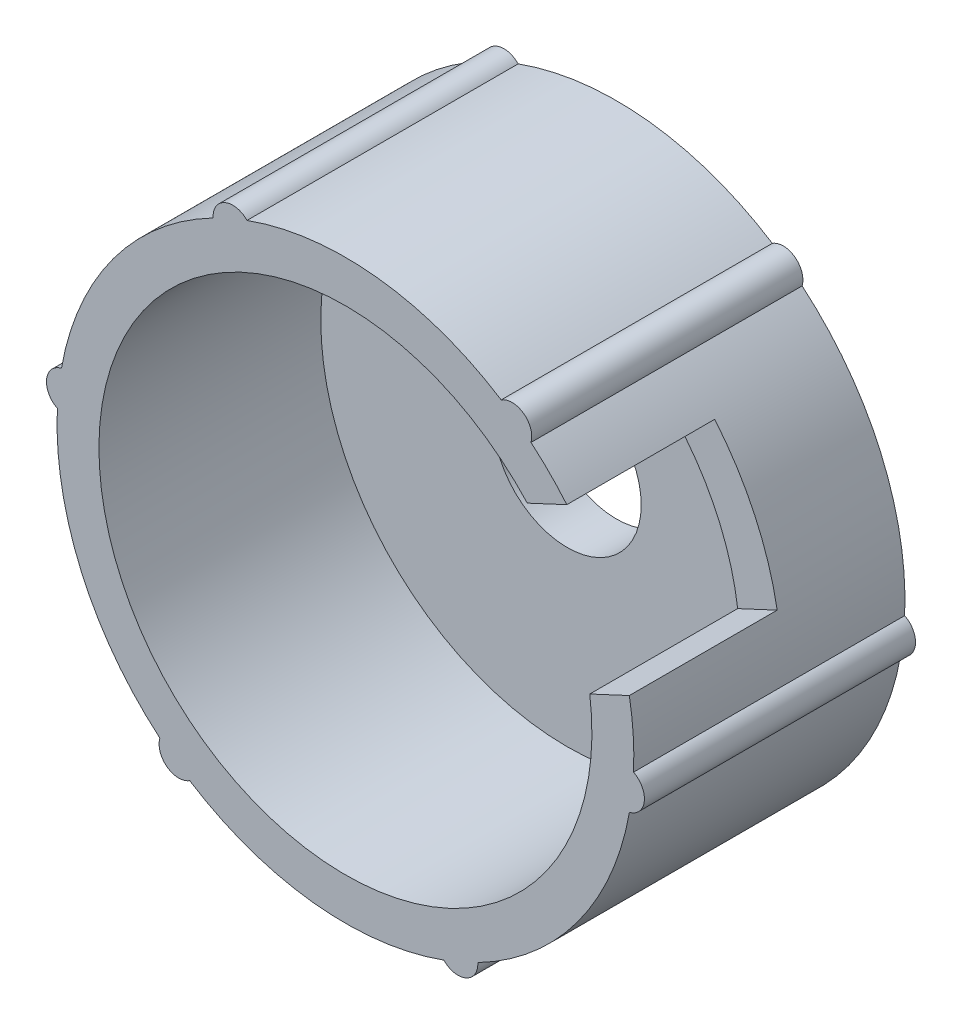
from build123d import *

# Parameters (mm, degrees)
SKIZZE2_R                       = 5
AUFSATZ_LINEAR_AUSTRAGEN1_DEPTH = 1
SKIZZE2_4_R                     = 5.85
SKIZZE2_4_R_2                   = 5
AUFSATZ_LINEAR_AUSTRAGEN2_DEPTH = 5.5
SKIZZE3_R                       = 0.4
AUFSATZ_LINEAR_AUSTRAGEN3_DEPTH = 5.5
KREISMUSTER1_COUNT              = 6
SCHNITT_LINEAR_AUSTRAGEN1_DEPTH = 3
SKIZZE5_R                       = 1.5
SCHNITT_LINEAR_AUSTRAGEN2_DEPTH = 102.03637778


with BuildPart() as part:
    # Skizze2 → Aufsatz-Linear austragen1 (new body)
    with BuildSketch(Plane.XY.offset(7.9)):
        with Locations((94, 7)):
            Circle(SKIZZE2_R)
    extrude(amount=AUFSATZ_LINEAR_AUSTRAGEN1_DEPTH)

    # Skizze2<4> → Aufsatz-Linear austragen2 (add)
    with BuildSketch(Plane.XY.offset(7.9)):
        with Locations(Location((94, 7, 0), (0, 0, 180))):
            Circle(SKIZZE2_4_R)
        with Locations(Location((94, 7, 0), (0, 0, 180))):
            Circle(SKIZZE2_4_R_2, mode=Mode.SUBTRACT)
    extrude(amount=AUFSATZ_LINEAR_AUSTRAGEN2_DEPTH)

    # Skizze3 → Aufsatz-Linear austragen3 (add)
    with BuildSketch(Plane.XY.offset(7.9)):
        with Locations((91.714816695, 12.22187105)):
            Circle(SKIZZE3_R)
    aufsatz_linear_austragen3 = extrude(amount=AUFSATZ_LINEAR_AUSTRAGEN3_DEPTH)

    # Kreismuster1: Aufsatz-Linear austragen3 ×6 about axis
    kreismuster1_axis = Axis((94, 7, 0), (0, 0, 1))
    for i in range(1, KREISMUSTER1_COUNT):
        add(aufsatz_linear_austragen3.rotate(kreismuster1_axis, i * 360 / KREISMUSTER1_COUNT))

    # Skizze4 → Schnitt-Linear austragen1 (cut)
    with BuildSketch(Plane.XY.offset(13.4)):
        Polygon((93.366072607, 8.359461681), (100.290761443, 11.588497115), (101.558616228, 8.869573754), (94.633927393, 5.640538319), align=None)
    extrude(amount=-SCHNITT_LINEAR_AUSTRAGEN1_DEPTH, mode=Mode.SUBTRACT)

    # Skizze5 → Schnitt-Linear austragen2 (cut, through all)
    with BuildSketch(Plane.XY.offset(7.9)):
        with Locations((94, 7)):
            Circle(SKIZZE5_R)
    extrude(amount=SCHNITT_LINEAR_AUSTRAGEN2_DEPTH, mode=Mode.SUBTRACT)


solid = part.part
